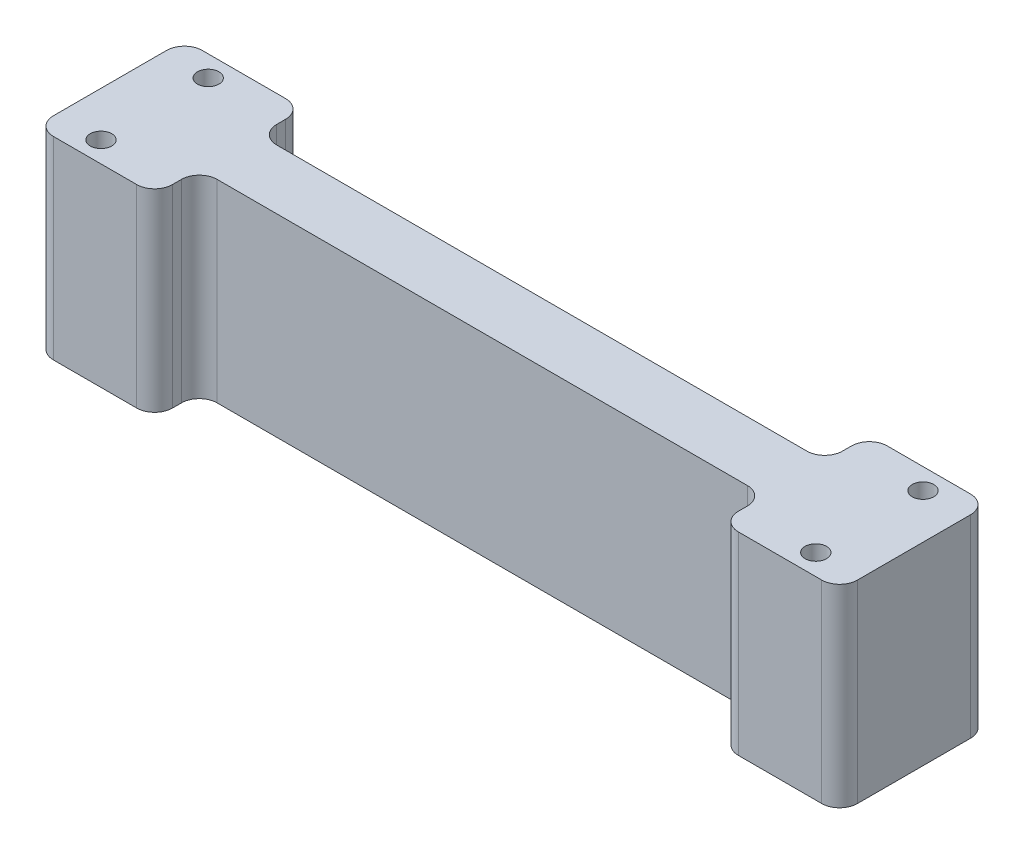
from build123d import *

# Parameters (mm, degrees)
SKETCH_1_R      = 1.8
EXTRUDE_1_DEPTH = 32.5
FILLET_1_R      = 3


with BuildPart() as part:
    # 草图1 → 凸台-拉伸1 (new body)
    with BuildSketch(Plane(origin=(0, 0, 0), x_dir=(1, 0, 0), z_dir=(0, 1, 0))):
        Polygon((-67.5, 12.5), (-67.5, -12.5), (-47.5, -12.5), (-47.5, -5), (47.5, -5), (47.5, -12.5), (67.5, -12.5), (67.5, 12.5), (47.5, 12.5), (47.5, 5), (-47.5, 5), (-47.5, 12.5), align=None)
        with Locations(Location((-60, -9, 0), (0, 0, 270))):
            Circle(SKETCH_1_R, mode=Mode.SUBTRACT)
        with Locations(Location((60, -9, 0), (0, 0, 270))):
            Circle(SKETCH_1_R, mode=Mode.SUBTRACT)
        with Locations(Location((-60, 9, 0), (0, 0, 270))):
            Circle(SKETCH_1_R, mode=Mode.SUBTRACT)
        with Locations(Location((60, 9, 0), (0, 0, 270))):
            Circle(SKETCH_1_R, mode=Mode.SUBTRACT)
    extrude(amount=EXTRUDE_1_DEPTH)

    # 圆角1
    fillet_1_edges = [part.edges().sort_by_distance(p)[0] for p in [
        (47.5, 16.25, -12.5),
        (67.5, 16.25, -12.5),
        (67.5, 16.25, 12.5),
        (47.5, 16.25, 12.5),
        (47.5, 16.25, 5),
        (-47.5, 16.25, 5),
        (-47.5, 16.25, 12.5),
        (-67.5, 16.25, 12.5),
        (-67.5, 16.25, -12.5),
        (-47.5, 16.25, -12.5),
        (-47.5, 16.25, -5),
        (47.5, 16.25, -5),
    ]]
    fillet(fillet_1_edges, radius=FILLET_1_R)


solid = part.part
